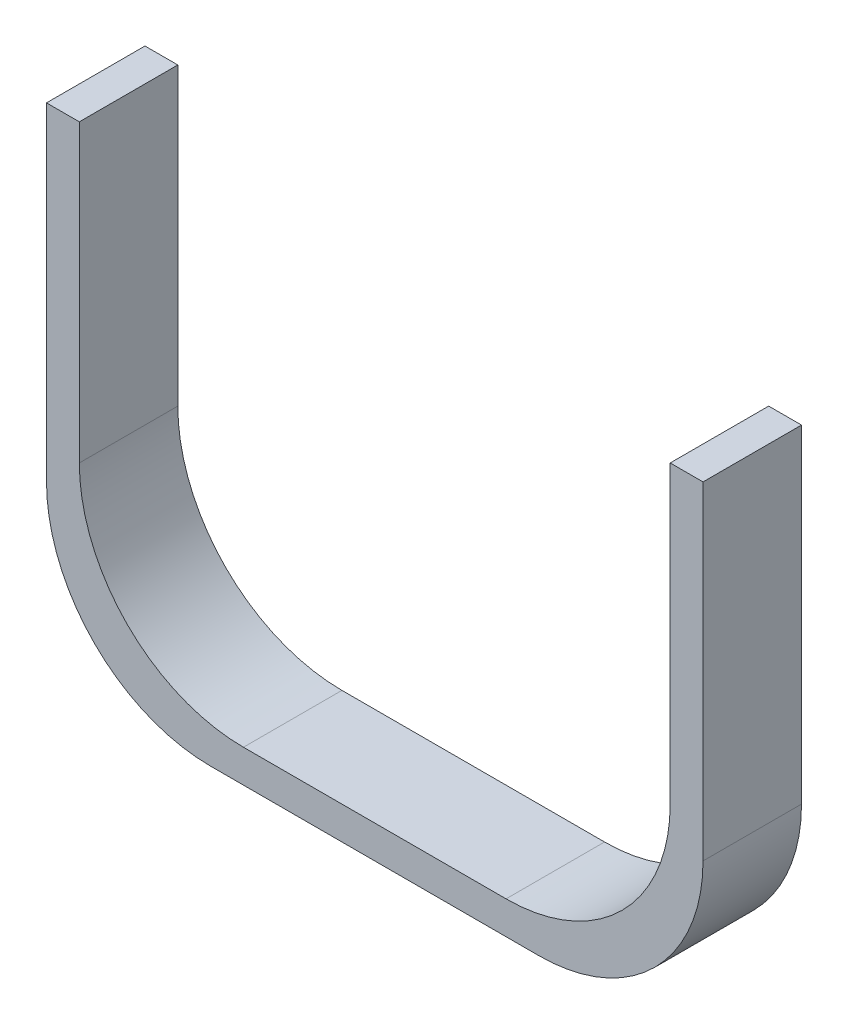
from build123d import *

# Parameters (mm, degrees)
BOSS_EXTRUDE1_DEPTH = 30
FILLET1_R           = 50
FILLET2_R           = 50


with BuildPart() as part:
    # Sketch1 → Boss-Extrude1 (new body)
    with BuildSketch(Plane.XY):
        Polygon((0, 0), (200, 0), (200, 150), (190, 150), (190, 10), (10, 10), (10, 150), (0, 150), align=None)
    extrude(amount=BOSS_EXTRUDE1_DEPTH)

    # Fillet1
    fillet1_edges = [part.edges().sort_by_distance(p)[0] for p in [
        (10, 10, 15),
        (190, 10, 15),
    ]]
    fillet(fillet1_edges, radius=FILLET1_R)

    # Fillet2
    fillet2_edges = [part.edges().sort_by_distance(p)[0] for p in [
        (200, 0, 15),
        (0, 0, 15),
    ]]
    fillet(fillet2_edges, radius=FILLET2_R)


solid = part.part
